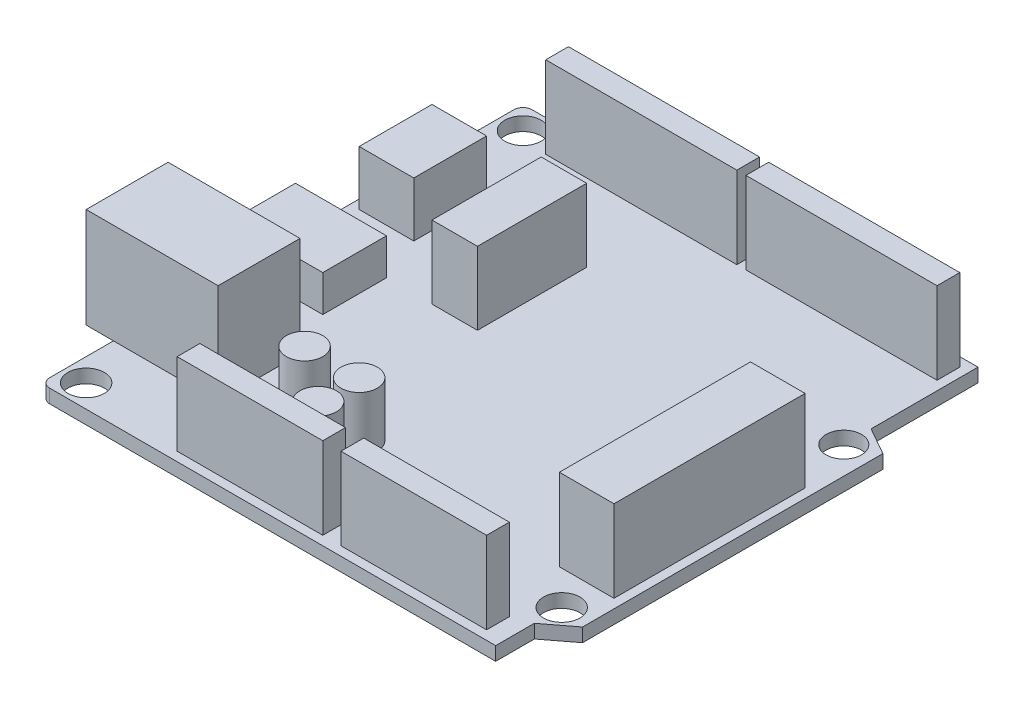
from build123d import *

# Parameters (mm, degrees)
SKETCH1_W           = 50
SKETCH1_H           = 53
BOSS_EXTRUDE1_DEPTH = 0.75
BOSS_EXTRUDE2_DEPTH = 1.5
SKETCH7_R           = 2
SKETCH7_R_2         = 1.948313055
CUT_EXTRUDE1_DEPTH  = 39.581083448
SKETCH8_W           = 21
SKETCH8_H           = 2.5
SKETCH8_W_2         = 6
SKETCH8_H_2         = 21
SKETCH8_W_3         = 16
BOSS_EXTRUDE3_DEPTH = 9
SKETCH9_R           = 2
BOSS_EXTRUDE4_DEPTH = 6
SKETCH10_W          = 14.5
SKETCH10_H          = 9
BOSS_EXTRUDE5_DEPTH = 11
SKETCH11_W          = 10
SKETCH11_H          = 7
BOSS_EXTRUDE6_DEPTH = 4
SKETCH12_W          = 6
SKETCH12_H          = 8
BOSS_EXTRUDE7_DEPTH = 6
SKETCH13_W          = 5
SKETCH13_H          = 12
BOSS_EXTRUDE8_DEPTH = 8
FILLET4_R           = 1
FILLET5_R           = 1


with BuildPart() as part:
    # Sketch1 → Boss-Extrude1 (new, symmetric)
    with BuildSketch(Plane(origin=(0, 0, 0), x_dir=(1, 0, 0), z_dir=(0, 1, 0))):
        Rectangle(SKETCH1_W, SKETCH1_H)
    extrude(amount=BOSS_EXTRUDE1_DEPTH, both=True)


with BuildPart() as body_2:
    # Sketch3 → Boss-Extrude2 (new body)
    with BuildSketch(Plane(origin=(0, 0.75, 0), x_dir=(1, 0, 0), z_dir=(0, 1, 0))):
        Polygon((25, -22.246887694), (25, 14.753112306), (28, 13.047029226), (28, -19.952970774), align=None)
    extrude(amount=-BOSS_EXTRUDE2_DEPTH)


with BuildPart() as cut_extrude1_tool:
    # Sketch7 → Cut-Extrude1 (new, through all)
    with BuildSketch(Plane(origin=(0, 0.75, 0), x_dir=(1, 0, 0), z_dir=(0, 1, 0))):
        with Locations(Location((-22.5, 24, 0), (0, 0, 270))):
            Circle(SKETCH7_R)
        with Locations(Location((-22.5, -24, 0), (0, 0, 270))):
            Circle(SKETCH7_R)
        with Locations((25, 11.753112306)):
            Circle(SKETCH7_R_2)
        with Locations((25, -19.246887694)):
            Circle(SKETCH7_R)
    extrude(amount=-CUT_EXTRUDE1_DEPTH)


with BuildPart() as part_1:
    add(part.part)

    # Cut-Extrude1: cut by cut_extrude1_tool
    add(cut_extrude1_tool.part, mode=Mode.SUBTRACT)



with BuildPart() as body_2_1:
    add(body_2.part)

    # Cut-Extrude1: cut by cut_extrude1_tool
    add(cut_extrude1_tool.part, mode=Mode.SUBTRACT)


with BuildPart() as part_2:
    add(part_1.part)

    add(body_2_1.part)  # Boss-Extrude3 merges body 2
    # Sketch8 → Boss-Extrude3 (add)
    with BuildSketch(Plane(origin=(0, 0.75, 0), x_dir=(1, 0, 0), z_dir=(0, 1, 0))):
        with Locations((13.5, 24.25)):
            Rectangle(SKETCH8_W, SKETCH8_H)
        with Locations((-8.5, 24.25)):
            Rectangle(SKETCH8_W, SKETCH8_H)
        with Locations((24, -5)):
            Rectangle(SKETCH8_W_2, SKETCH8_H_2)
        with Locations((15, -24.25)):
            Rectangle(SKETCH8_W_3, SKETCH8_H)
        with Locations((-3, -24.25)):
            Rectangle(SKETCH8_W_3, SKETCH8_H)
    extrude(amount=BOSS_EXTRUDE3_DEPTH)

    # Sketch9 → Boss-Extrude4 (add)
    with BuildSketch(Plane(origin=(0, 0.75, 0), x_dir=(1, 0, 0), z_dir=(0, 1, 0))):
        with Locations(Location((-2, -19, 0), (0, 0, 270))):
            Circle(SKETCH9_R)
        with Locations(Location((-2, -14.5, 0), (0, 0, 270))):
            Circle(SKETCH9_R)
        with Locations(Location((-8, -14.5, 0), (0, 0, 270))):
            Circle(SKETCH9_R)
    extrude(amount=BOSS_EXTRUDE4_DEPTH)

    # Sketch10 → Boss-Extrude5 (add)
    with BuildSketch(Plane(origin=(0, 0.75, 0), x_dir=(1, 0, 0), z_dir=(0, 1, 0))):
        with Locations((-20.75, -14)):
            Rectangle(SKETCH10_W, SKETCH10_H)
    extrude(amount=BOSS_EXTRUDE5_DEPTH)

    # Sketch11 → Boss-Extrude6 (add)
    with BuildSketch(Plane(origin=(0, 0.75, 0), x_dir=(1, 0, 0), z_dir=(0, 1, 0))):
        with Locations((-21, -1)):
            Rectangle(SKETCH11_W, SKETCH11_H)
    extrude(amount=BOSS_EXTRUDE6_DEPTH)

    # Sketch12 → Boss-Extrude7 (add)
    with BuildSketch(Plane(origin=(0, 0.75, 0), x_dir=(1, 0, 0), z_dir=(0, 1, 0))):
        with Locations((-21, 11.5)):
            Rectangle(SKETCH12_W, SKETCH12_H)
    extrude(amount=BOSS_EXTRUDE7_DEPTH)

    # Sketch13 → Boss-Extrude8 (add)
    with BuildSketch(Plane(origin=(0, 0.75, 0), x_dir=(1, 0, 0), z_dir=(0, 1, 0))):
        with Locations((-8.5, 8.5)):
            Rectangle(SKETCH13_W, SKETCH13_H)
    extrude(amount=BOSS_EXTRUDE8_DEPTH)

    # Fillet4
    fillet4_edges = [part_2.edges().sort_by_distance(p)[0] for p in [
        (-25, 0, -26.5),
    ]]
    fillet(fillet4_edges, radius=FILLET4_R)

    # Fillet5
    fillet5_edges = [part_2.edges().sort_by_distance(p)[0] for p in [
        (-25, 0, 26.5),
    ]]
    fillet(fillet5_edges, radius=FILLET5_R)


solid = part_2.part
